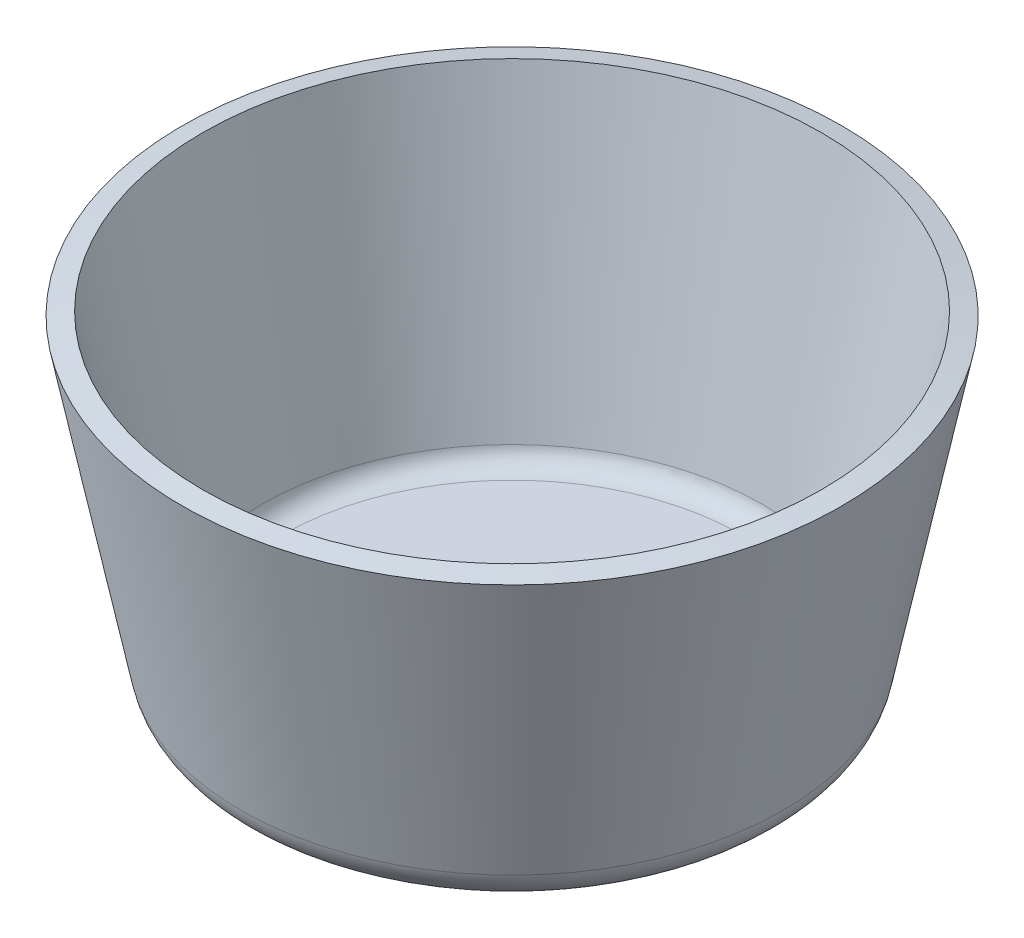
from build123d import *


with BuildPart() as part:
    # 草图2 → 旋转-薄壁3 (revolve)
    with BuildSketch(Plane(origin=(0, 0, 0), x_dir=(0, 0, -1), z_dir=(1, 0, 0))):
        with BuildLine():
            Line((0, 0), (111.801960973, 0))
            ThreePointArc((111.801960973, 0), (118.141850029, 2.266578587), (121.60776773, 8.038838649))
            Line((121.60776773, 8.038838649), (150, 150))
            Line((150, 150), (159.805806757, 148.038838649))
            Line((159.805806757, 148.038838649), (131.413574487, 6.077677297))
            ThreePointArc((131.413574487, 6.077677297), (124.481739085, -5.466842827), (111.801960973, -10))
            Line((111.801960973, -10), (0, -10))
            Line((0, -10), (0, 0))
        make_face()
    revolve(axis=Axis((0, 0, 0), (0, 1, 0)))


solid = part.part
